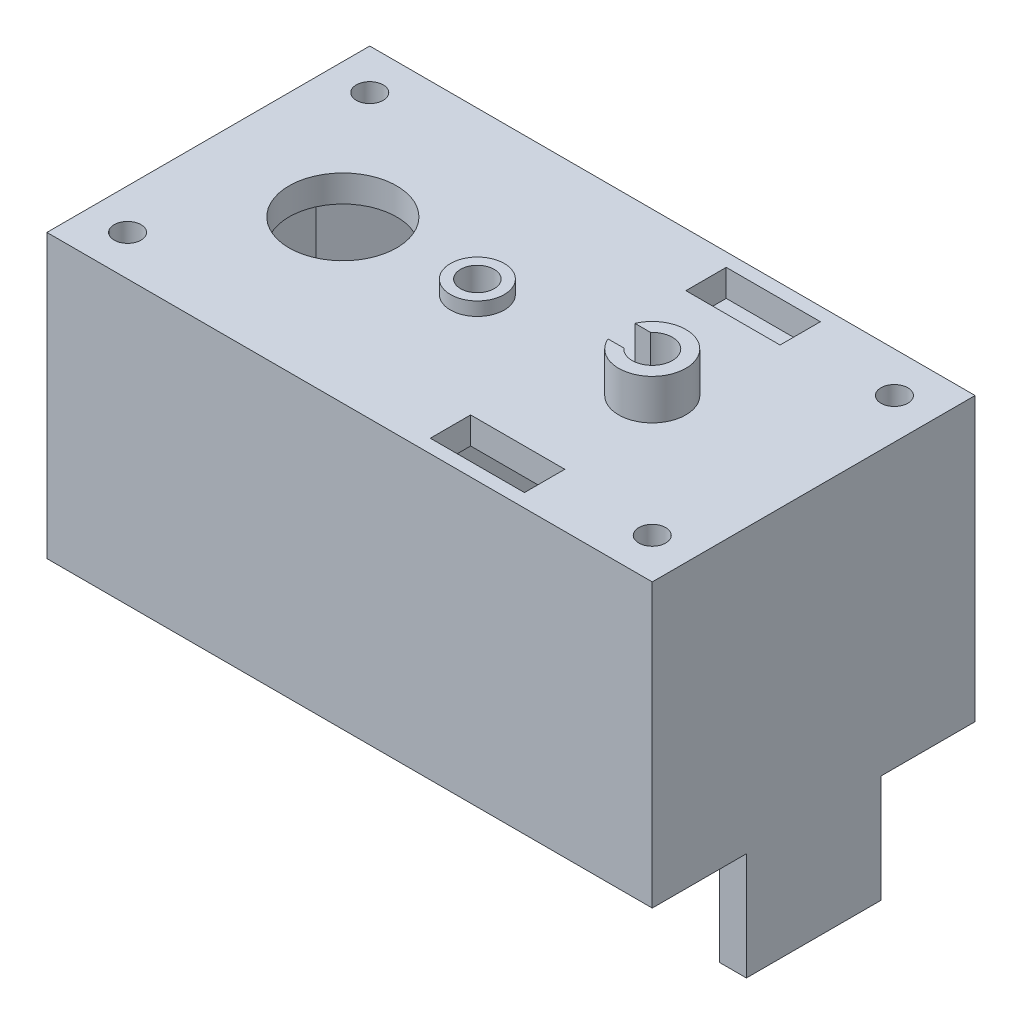
from build123d import *
from build123d.topology import SkipClean

# Parameters (mm, degrees)
SKETCH1_W           = 22.5
SKETCH1_H           = 12
SKETCH1_W_2         = 11.5
SKETCH1_H_2         = 10
SKETCH1_W_3         = 8
BOSS_EXTRUDE1_DEPTH = 10.5
SKETCH2_W           = 22.5
SKETCH2_H           = 12
SKETCH2_R           = 2
SKETCH2_R_2         = 0.75
SKETCH2_W_2         = 3.5
SKETCH2_H_2         = 1.5
BOSS_EXTRUDE2_DEPTH = 1
SKETCH3_W           = 3.5
SKETCH3_H           = 1.5
CUT_EXTRUDE1_DEPTH  = 1
SKETCH4_W           = 10
SKETCH4_H           = 2.5
CUT_EXTRUDE2_DEPTH  = 1
CHAMFER1_SIZE       = 2
SKETCH5_R           = 0.5
CUT_EXTRUDE3_DEPTH  = 17.517036659
SKETCH6_W           = 1
SKETCH6_H           = 5
BOSS_EXTRUDE3_DEPTH = 4
BOSS_EXTRUDE4_DEPTH = 1.75
SKETCH8_R           = 0.625
CUT_EXTRUDE4_DEPTH  = 1.75
SKETCH9_R           = 1
BOSS_EXTRUDE5_DEPTH = 0.25
BOSS_EXTRUDE6_START = 0.5
SKETCH10_R          = 1
SKETCH10_R_2        = 0.625
BOSS_EXTRUDE6_DEPTH = 0.5
BOSS_EXTRUDE7_START = 1.5
SKETCH11_R          = 1.25
SKETCH11_R_2        = 0.75
BOSS_EXTRUDE7_DEPTH = 1.5
CUT_EXTRUDE5_DEPTH  = 1.5


with BuildPart() as part:
    # Sketch1 → Boss-Extrude1 (new body)
    with BuildSketch(Plane(origin=(0, 0, 0), x_dir=(1, 0, 0), z_dir=(0, 1, 0))):
        Rectangle(SKETCH1_W, SKETCH1_H)
        with Locations((4.5, 0)):
            Rectangle(SKETCH1_W_2, SKETCH1_H_2, mode=Mode.SUBTRACT)
        with Locations((-6.25, 0)):
            Rectangle(SKETCH1_W_3, SKETCH1_H_2, mode=Mode.SUBTRACT)
    extrude(amount=BOSS_EXTRUDE1_DEPTH)

    # Sketch2 → Boss-Extrude2 (add)
    with BuildSketch(Plane(origin=(0, 10.5, 0), x_dir=(1, 0, 0), z_dir=(0, 1, 0))):
        Rectangle(SKETCH2_W, SKETCH2_H)
        with Locations(Location((-6.25, 0, 0), (0, 0, 270))):
            Circle(SKETCH2_R, mode=Mode.SUBTRACT)
        with Locations(Location((5.25, 0, 0), (0, 0, 270))):
            Circle(SKETCH2_R_2, mode=Mode.SUBTRACT)
        with Locations((4.25, 4.75)):
            Rectangle(SKETCH2_W_2, SKETCH2_H_2, mode=Mode.SUBTRACT)
        with Locations((4.25, -4.75)):
            Rectangle(SKETCH2_W_2, SKETCH2_H_2, mode=Mode.SUBTRACT)
    extrude(amount=-BOSS_EXTRUDE2_DEPTH)

    # Sketch3 → Cut-Extrude1 (cut)
    with BuildSketch(Plane(origin=(0, 10.5, 0), x_dir=(1, 0, 0), z_dir=(0, 1, 0))):
        with Locations((4.25, 4.75)):
            Rectangle(SKETCH3_W, SKETCH3_H)
        with Locations((4.25, -4.75)):
            Rectangle(SKETCH3_W, SKETCH3_H)
    extrude(amount=-CUT_EXTRUDE1_DEPTH, mode=Mode.SUBTRACT)

    # Sketch4 → Cut-Extrude2 (cut)
    with BuildSketch(Plane.ZY.offset(2.25)):
        with Locations((0, 1.25)):
            Rectangle(SKETCH4_W, SKETCH4_H)
    extrude(amount=-CUT_EXTRUDE2_DEPTH, mode=Mode.SUBTRACT)

    # Chamfer1
    chamfer1_edges = [part.edges().sort_by_distance(p)[0] for p in [
        (-10.25, 4.75, 5),
        (-10.25, 4.75, -5),
        (10.25, 4.75, -5),
        (10.25, 4.75, 5),
    ]]
    chamfer(chamfer1_edges, length=CHAMFER1_SIZE)

    # Sketch5 → Cut-Extrude3 (cut, through all)
    with BuildSketch(Plane.XZ):
        with Locations(Location((-9.75, 4.5, 0), (0, 0, 270))):
            Circle(SKETCH5_R)
        with Locations(Location((9.75, 4.5, 0), (0, 0, 90))):
            Circle(SKETCH5_R)
        with Locations(Location((9.75, -4.5, 0), (0, 0, 270))):
            Circle(SKETCH5_R)
        with Locations(Location((-9.75, -4.5, 0), (0, 0, 90))):
            Circle(SKETCH5_R)
    extrude(amount=-CUT_EXTRUDE3_DEPTH, mode=Mode.SUBTRACT)

    # Sketch6 → Boss-Extrude3 (add)
    with BuildSketch(Plane.XZ):
        with Locations((10.75, 0)):
            Rectangle(SKETCH6_W, SKETCH6_H)
    extrude(amount=BOSS_EXTRUDE3_DEPTH)

    # Sketch7 → Boss-Extrude4 (add)
    with BuildSketch(Plane(origin=(0, 10.5, 0), x_dir=(1, 0, 0), z_dir=(0, 1, 0))):
        with BuildLine():
            ThreePointArc((-1.25, 1), (-2.25, 0), (-1.25, -1))
            Line((-1.25, -1), (-1.25, -0.625))
            ThreePointArc((-1.25, -0.625), (-1.875, 0), (-1.25, 0.625))
            Line((-1.25, 0.625), (-1.25, 1))
        make_face()
        with BuildLine():
            Line((-1.25, -0.625), (-1.25, -1))
            ThreePointArc((-1.25, -1), (-0.542893219, -0.707106781), (-0.25, 0))
            ThreePointArc((-0.25, 0), (-0.542893219, 0.707106781), (-1.25, 1))
            Line((-1.25, 1), (-1.25, 0.625))
            ThreePointArc((-1.25, 0.625), (-0.808058262, 0.441941738), (-0.625, 0))
            ThreePointArc((-0.625, 0), (-0.808058262, -0.441941738), (-1.25, -0.625))
        make_face()
    extrude(amount=-BOSS_EXTRUDE4_DEPTH)

    # Sketch8 → Cut-Extrude4 (cut)
    with BuildSketch(Plane(origin=(0, 10.5, 0), x_dir=(1, 0, 0), z_dir=(0, 1, 0))):
        with Locations(Location((-1.25, 0, 0), (0, 0, 270))):
            Circle(SKETCH8_R)
    extrude(amount=-CUT_EXTRUDE4_DEPTH, mode=Mode.SUBTRACT)

    # Sketch9 → Boss-Extrude5 (add)
    with SkipClean():  # the faces are left unmerged after this step: merging them gives an invalid solid
        with BuildSketch(Plane.XZ.offset(-8.75)):
            with Locations((-1.25, 0)):
                Circle(SKETCH9_R)
        extrude(amount=BOSS_EXTRUDE5_DEPTH)

    # Sketch10 → Boss-Extrude6 (add)
    with SkipClean():  # the faces are left unmerged after this step: merging them gives an invalid solid
        with BuildSketch(Plane(origin=(0, 10.5, 0), x_dir=(1, 0, 0), z_dir=(0, 1, 0)).offset(BOSS_EXTRUDE6_START)):
            with Locations(Location((-1.25, 0, 0), (0, 0, 270))):
                Circle(SKETCH10_R)
            with Locations(Location((-1.25, 0, 0), (0, 0, 270))):
                Circle(SKETCH10_R_2, mode=Mode.SUBTRACT)
        extrude(amount=-BOSS_EXTRUDE6_DEPTH)

    # Sketch11 → Boss-Extrude7 (add)
    with SkipClean():  # the faces are left unmerged after this step: merging them gives an invalid solid
        with BuildSketch(Plane(origin=(0, 10.5, 0), x_dir=(1, 0, 0), z_dir=(0, 1, 0)).offset(BOSS_EXTRUDE7_START)):
            with Locations(Location((5.25, 0, 0), (0, 0, 270))):
                Circle(SKETCH11_R)
            with Locations(Location((5.25, 0, 0), (0, 0, 270))):
                Circle(SKETCH11_R_2, mode=Mode.SUBTRACT)
        extrude(amount=-BOSS_EXTRUDE7_DEPTH)

    # Sketch12 → Cut-Extrude5 (cut)
    with SkipClean():  # the faces are left unmerged after this step: merging them gives an invalid solid
        with BuildSketch(Plane(origin=(0, 12, 0), x_dir=(1, 0, 0), z_dir=(0, 1, 0))):
            with BuildLine():
                Line((4.104356076, 0.5), (4.690983006, 0.5))
                ThreePointArc((4.690983006, 0.5), (4.5, 0), (4.690983006, -0.5))
                Line((4.690983006, -0.5), (4.104356076, -0.5))
                ThreePointArc((4.104356076, -0.5), (4, 0), (4.104356076, 0.5))
            make_face()
        extrude(amount=-CUT_EXTRUDE5_DEPTH, mode=Mode.SUBTRACT)


solid = part.part
